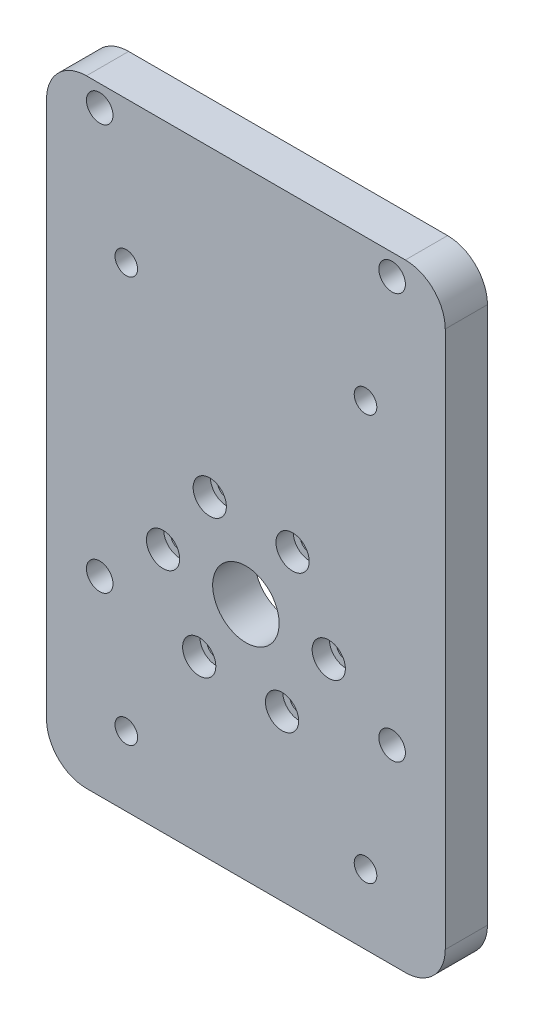
from build123d import *

# Parameters (mm, degrees)
DISCO_1_4IN_START                     = 269.6
DISCO_1_4IN_DEPTH                     = 6.35
BARRENOS_M4_ESCUADRAS_PASADORES_START = 269.6
CROQUIS14_R                           = 1.45
CROQUIS14_R_2                         = 5
CROQUIS14_R_3                         = 1.25
CROQUIS14_R_4                         = 2
BARRENOS_M4_ESCUADRAS_PASADORES_DEPTH = 6.35
REFRENTADO_M2_5_START                 = 273.35
CROQUIS15_R                           = 2.5
REFRENTADO_M2_5_DEPTH                 = 2.6
PASO_M3_ESCUADRAS_TUERCA_START        = 269.6
CROQUIS16_R                           = 1.7
PASO_M3_ESCUADRAS_TUERCA_DEPTH        = 6.35


with BuildPart() as part:
    # Croquis13 → Disco_1-4in (new body)
    with BuildSketch(Plane.XY.offset(DISCO_1_4IN_START)):
        with BuildLine():
            Line((128.4, -36), (176.4, -36))
            ThreePointArc((176.4, -36), (180.642640687, -34.242640687), (182.4, -30))
            Line((182.4, -30), (182.4, 50.875))
            ThreePointArc((182.4, 50.875), (180.642640687, 55.117640687), (176.4, 56.875))
            Line((176.4, 56.875), (128.4, 56.875))
            ThreePointArc((128.4, 56.875), (124.157359313, 55.117640687), (122.4, 50.875))
            Line((122.4, 50.875), (122.4, -30))
            ThreePointArc((122.4, -30), (124.157359313, -34.242640687), (128.4, -36))
        make_face()
    extrude(amount=DISCO_1_4IN_DEPTH)

    # Croquis14 → Barrenos_M4_escuadras_pasadores (cut)
    with BuildSketch(Plane.XY.offset(BARRENOS_M4_ESCUADRAS_PASADORES_START)):
        with Locations((159.426042223, 10.338507178)):
            Circle(CROQUIS14_R)
        with Locations((146.959611258, 11.253984643)):
            Circle(CROQUIS14_R)
        with Locations((139.933569035, 0.915477464)):
            Circle(CROQUIS14_R)
        with Locations((145.373957777, -10.338507178)):
            Circle(CROQUIS14_R)
        with Locations((157.840388742, -11.253984643)):
            Circle(CROQUIS14_R)
        with Locations((164.866430965, -0.915477464)):
            Circle(CROQUIS14_R)
        with Locations((152.4, 0)):
            Circle(CROQUIS14_R_2)
        with Locations((134.4, 35.525)):
            Circle(CROQUIS14_R_3)
        with Locations((134.4, -25.525)):
            Circle(CROQUIS14_R_3)
        with Locations((170.4, 35.525)):
            Circle(CROQUIS14_R_3)
        with Locations((170.4, -25.525)):
            Circle(CROQUIS14_R_3)
        with Locations((130.4, 53.7)):
            Circle(CROQUIS14_R_4)
        with Locations((130.4, -7.35)):
            Circle(CROQUIS14_R_4)
        with Locations((174.4, 53.7)):
            Circle(CROQUIS14_R_4)
        with Locations((174.4, -7.35)):
            Circle(CROQUIS14_R_4)
    extrude(amount=BARRENOS_M4_ESCUADRAS_PASADORES_DEPTH, mode=Mode.SUBTRACT)

    # Croquis15 → Refrentado_M2-5 (cut)
    with BuildSketch(Plane.XY.offset(REFRENTADO_M2_5_START)):
        with Locations((159.426042223, 10.338507178)):
            Circle(CROQUIS15_R)
        with Locations((146.959611258, 11.253984643)):
            Circle(CROQUIS15_R)
        with Locations((139.933569035, 0.915477464)):
            Circle(CROQUIS15_R)
        with Locations((145.373957777, -10.338507178)):
            Circle(CROQUIS15_R)
        with Locations((157.840388742, -11.253984643)):
            Circle(CROQUIS15_R)
        with Locations((164.866430965, -0.915477464)):
            Circle(CROQUIS15_R)
    extrude(amount=REFRENTADO_M2_5_DEPTH, mode=Mode.SUBTRACT)

    # Croquis16 → Paso_M3_escuadras_tuerca (cut)
    with BuildSketch(Plane.XY.offset(PASO_M3_ESCUADRAS_TUERCA_START)):
        with Locations((134.4, 35.525)):
            Circle(CROQUIS16_R)
        with Locations((134.4, -25.525)):
            Circle(CROQUIS16_R)
        with Locations((170.4, 35.525)):
            Circle(CROQUIS16_R)
        with Locations((170.4, -25.525)):
            Circle(CROQUIS16_R)
    extrude(amount=PASO_M3_ESCUADRAS_TUERCA_DEPTH, mode=Mode.SUBTRACT)


solid = part.part
